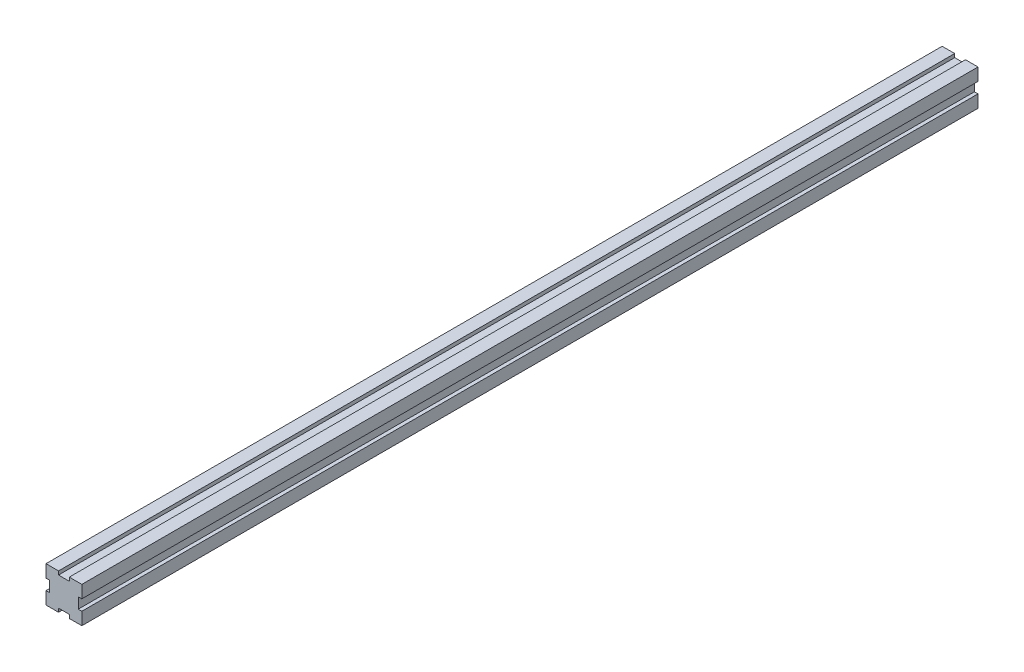
from build123d import *

# Parameters (mm, degrees)
EXTRUDE_1_DEPTH = 500


with BuildPart() as part:
    # 草图1 → 凸台-拉伸1 (new body)
    with BuildSketch(Plane.XY):
        Polygon((0, -13), (0, -20), (7, -20), (7, -18), (13, -18), (13, -20), (20, -20), (20, -13), (18, -13), (18, -7), (20, -7), (20, 0), (13, 0), (13, -2), (7, -2), (7, 0), (0, 0), (0, -7), (2, -7), (2, -13), align=None)
    extrude(amount=EXTRUDE_1_DEPTH)


solid = part.part
